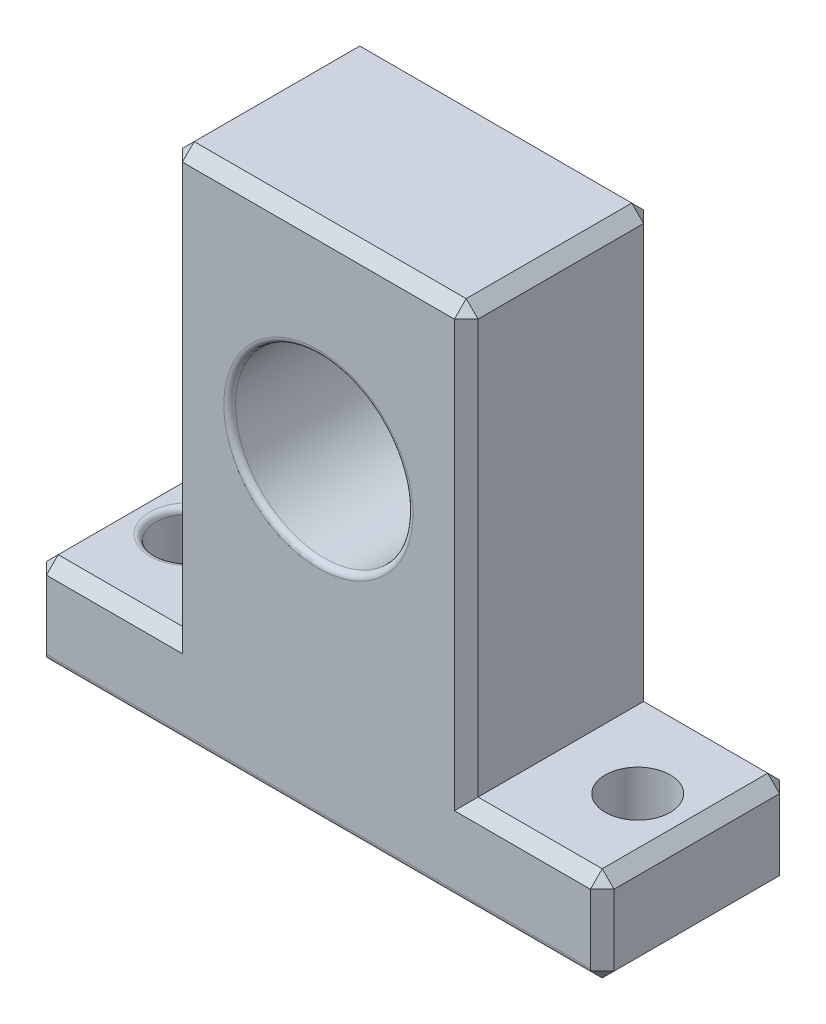
from build123d import *

# Parameters (mm, degrees)
SKETCH_1_W          = 48
SKETCH_1_H          = 16
SKETCH_1_R          = 2.75
EXTRUDE_1_DEPTH     = 8
EXTRUDE_2_DEPTH     = 36
SKETCH_3_R          = 7.5
CUT_EXTRUDE_1_DEPTH = 36
CHAMFER_1_SIZE      = 1
FILLET_1_R          = 0.5


with BuildPart() as part:
    # 草图1 → 凸台-拉伸1 (new body)
    with BuildSketch(Plane(origin=(0, 0, 0), x_dir=(1, 0, 0), z_dir=(0, 1, 0))):
        Rectangle(SKETCH_1_W, SKETCH_1_H)
        with Locations(Location((19, 0, 0), (0, 0, 270))):
            Circle(SKETCH_1_R, mode=Mode.SUBTRACT)
        with Locations(Location((-19, 0, 0), (0, 0, 270))):
            Circle(SKETCH_1_R, mode=Mode.SUBTRACT)
    extrude(amount=EXTRUDE_1_DEPTH)

    # 草图2 → 凸台-拉伸2 (add)
    with BuildSketch(Plane(origin=(0, 8, 0), x_dir=(1, 0, 0), z_dir=(0, 1, 0))):
        Polygon((12.5, -8), (12.5, 8), (-12.5, 8), align=None)
        Polygon((-12.5, -8), (12.5, -8), (-12.5, 8), align=None)
    extrude(amount=EXTRUDE_2_DEPTH)

    # 草图3 → 切除-拉伸1 (cut)
    with BuildSketch(Plane.XY.offset(8)):
        with Locations((0, 27)):
            Circle(SKETCH_3_R)
    extrude(amount=-CUT_EXTRUDE_1_DEPTH, mode=Mode.SUBTRACT)

    # 倒角1
    chamfer_1_edges = [part.edges().sort_by_distance(p)[0] for p in [
        (24, 8, 0),
        (18.25, 8, -8),
        (18.25, 8, 8),
        (-18.25, 8, -8),
        (12.5, 26, -8),
        (-12.5, 26, -8),
        (-12.5, 26, 8),
        (12.5, 44, 0),
        (12.5, 26, 8),
        (0, 44, -8),
        (-12.5, 44, 0),
        (0, 44, 8),
        (-24, 8, 0),
        (0, 0, -8),
        (24, 0, 0),
        (0, 0, 8),
        (-24, 0, 0),
        (-24, 4, -8),
        (24, 4, -8),
        (24, 4, 8),
        (-24, 4, 8),
        (-18.25, 8, 8),
    ]]
    chamfer(chamfer_1_edges, length=CHAMFER_1_SIZE)

    # 圆角1
    fillet_1_edges = [part.edges().sort_by_distance(p)[0] for p in [
        (-19, 0, -2.75),
        (-19, 8, -2.75),
        (-7.5, 27, -8),
        (-7.5, 27, 8),
        (0, 1, 8),
    ]]
    fillet(fillet_1_edges, radius=FILLET_1_R)


solid = part.part
